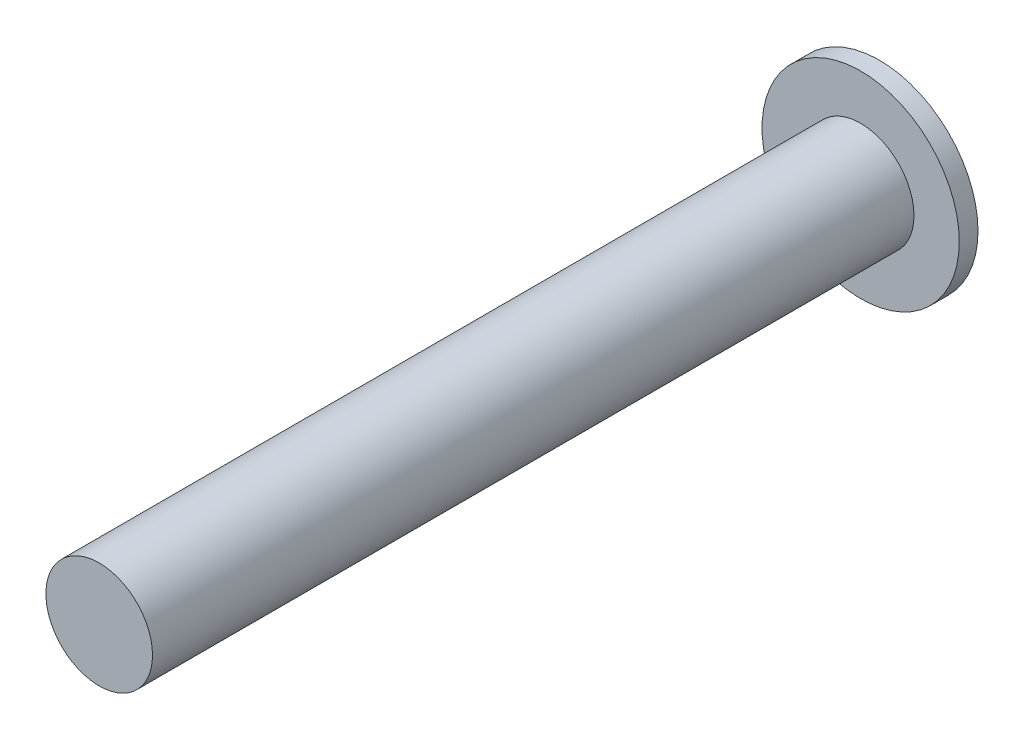
from build123d import *

# Parameters (mm, degrees)
SKETCH2_R           = 6.475
BOSS_EXTRUDE1_DEPTH = 1.23
SKETCH4_R           = 3.5
BOSS_EXTRUDE2_DEPTH = 50


with BuildPart() as part:
    # Sketch2 → Boss-Extrude1 (new body)
    with BuildSketch(Plane.XY):
        Circle(SKETCH2_R)
    extrude(amount=BOSS_EXTRUDE1_DEPTH)

    # Sketch4 → Boss-Extrude2 (add)
    with BuildSketch(Plane.XY.offset(1.23)):
        Circle(SKETCH4_R)
    extrude(amount=BOSS_EXTRUDE2_DEPTH)


solid = part.part
